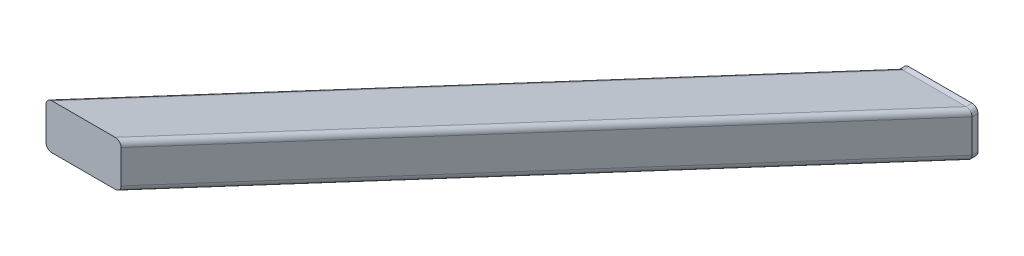
from build123d import *

# Parameters (mm, degrees)
SALIENTE_EXTRUIR1_DEPTH = 10


with BuildPart() as part:
    # Croquis1 → Saliente-Extruir1 (new body)
    with BuildSketch(Plane.XY):
        with BuildLine():
            Line((10, 0), (117, 0))
            ThreePointArc((117, 0), (124.071067812, -2.928932188), (127, -10))
            Line((127, -10), (127, -66.2))
            ThreePointArc((127, -66.2), (124.071067812, -73.271067812), (117, -76.2))
            Line((117, -76.2), (10, -76.2))
            ThreePointArc((10, -76.2), (2.928932188, -73.271067812), (0, -66.2))
            Line((0, -66.2), (0, -10))
            ThreePointArc((0, -10), (2.928932188, -2.928932188), (10, 0))
        make_face()
    extrude(amount=SALIENTE_EXTRUIR1_DEPTH)

    # Barrer1: sweep along a curve in space
    with BuildLine() as barrer1_path:
        Line((-386.5, 186.9, 1000), (63.5, -38.1, 10))
    # Croquis2 → Barrer1 (sweep)
    with BuildSketch(Plane.XY.offset(10)):
        with BuildLine():
            Line((10, -76.2), (117, -76.2))
            ThreePointArc((117, -76.2), (124.071067812, -73.271067812), (127, -66.2))
            Line((127, -66.2), (127, -10))
            ThreePointArc((127, -10), (124.071067812, -2.928932188), (117, 0))
            Line((117, 0), (10, 0))
            ThreePointArc((10, 0), (2.928932188, -2.928932188), (0, -10))
            Line((0, -10), (0, -66.2))
            ThreePointArc((0, -66.2), (2.928932188, -73.271067812), (10, -76.2))
        make_face()
    sweep(path=barrer1_path.line)


solid = part.part
